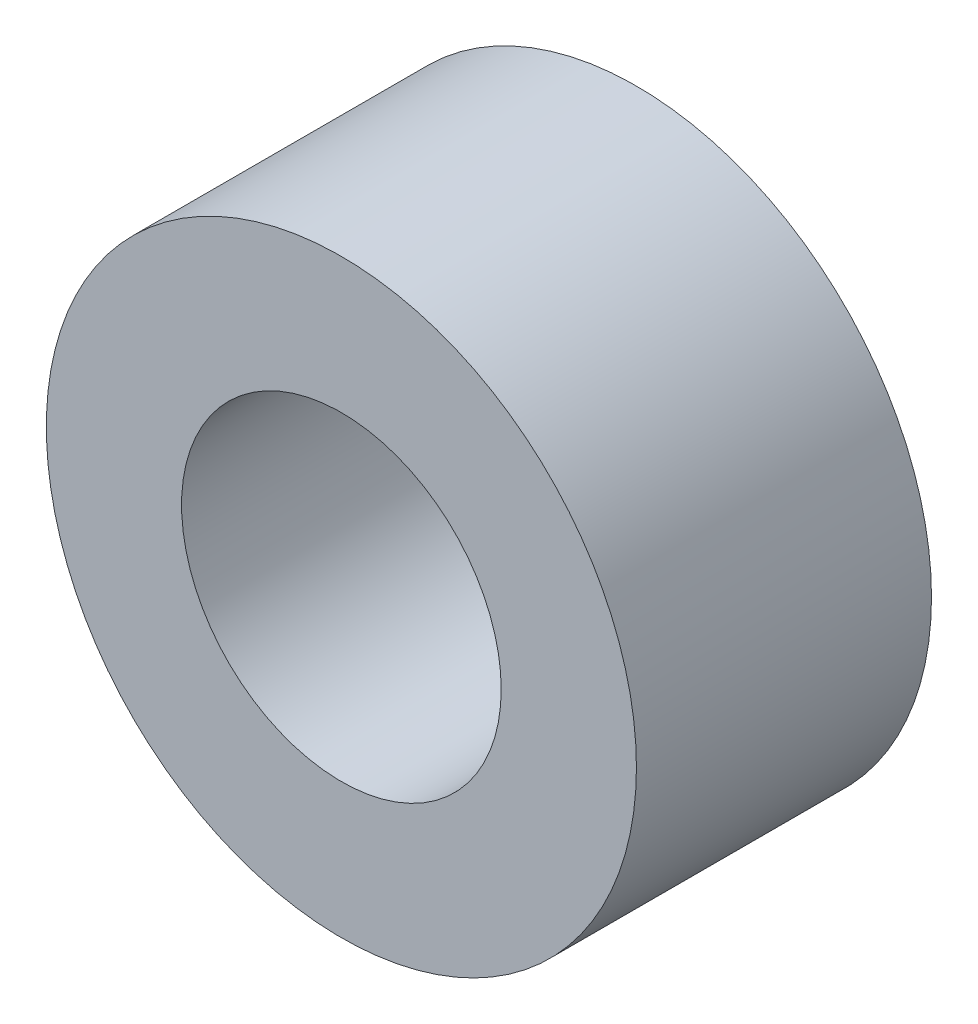
from build123d import *

# Parameters (mm, degrees)
CROQUIS1_R              = 6
CROQUIS1_R_2            = 3.25
SALIENTE_EXTRUIR1_DEPTH = 6


with BuildPart() as part:
    # Croquis1 → Saliente-Extruir1 (new body)
    with BuildSketch(Plane.XY):
        Circle(CROQUIS1_R)
        Circle(CROQUIS1_R_2, mode=Mode.SUBTRACT)
    extrude(amount=SALIENTE_EXTRUIR1_DEPTH)


solid = part.part
